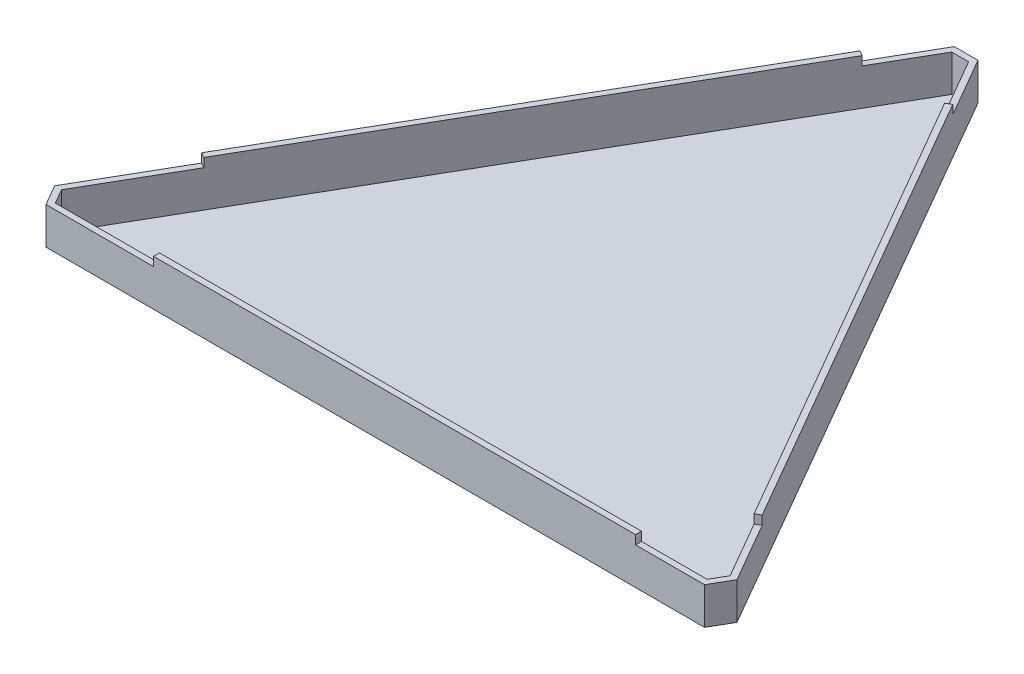
from build123d import *

# Parameters (mm, degrees)
BOSS_EXTRUDE1_DEPTH = 0.08
BOSS_EXTRUDE2_DEPTH = 12.46
SKETCH1_4_W         = 162.49
SKETCH1_4_H         = 2
BOSS_EXTRUDE3_DEPTH = 15.46


with BuildPart() as part:
    # Sketch1 → Boss-Extrude1 (new body)
    with BuildSketch(Plane(origin=(0, 0, 0), x_dir=(1, 0, 0), z_dir=(0, 1, 0))):
        Polygon((-115, 0), (-111, -6.92820323), (111, -6.92820323), (115, 0), (4, 192.25763964), (-4, 192.25763964), align=None)
    extrude(amount=BOSS_EXTRUDE1_DEPTH)

    # Sketch1<3> → Boss-Extrude2 (add)
    with BuildSketch(Plane(origin=(0, 0, 0), x_dir=(1, 0, 0), z_dir=(0, 1, 0))):
        Polygon((-96.87, 31.402081141), (-115, 0), (-111, -6.92820323), (-74.74, -6.92820323), (-74.74, -4.92820323), (-109.845299462, -4.92820323), (-112.690598923, 0), (-95.137949192, 30.402081141), align=None)
        Polygon((-4, 192.25763964), (-15.625, 172.122549002), (-13.892949192, 171.122549002), (-2.845299462, 190.25763964), (2.845299462, 190.25763964), (13.892949192, 171.122549002), (15.625, 172.122549002), (4, 192.25763964), align=None)
        Polygon((87.75, -4.92820323), (87.75, -6.92820323), (111, -6.92820323), (115, 0), (103.375, 20.135090638), (101.642949192, 19.135090638), (112.690598923, 0), (109.845299462, -4.92820323), align=None)
    extrude(amount=BOSS_EXTRUDE2_DEPTH)

    # Sketch1<4> → Boss-Extrude3 (add)
    with BuildSketch(Plane(origin=(0, 0, 0), x_dir=(1, 0, 0), z_dir=(0, 1, 0))):
        Polygon((-15.625, 172.122549002), (-96.87, 31.402081141), (-95.137949192, 30.402081141), (-13.892949192, 171.122549002), align=None)
        with Locations((6.505, -5.92820323)):
            Rectangle(SKETCH1_4_W, SKETCH1_4_H)
        Polygon((103.375, 20.135090638), (15.625, 172.122549002), (13.892949192, 171.122549002), (101.642949192, 19.135090638), align=None)
    extrude(amount=BOSS_EXTRUDE3_DEPTH)


solid = part.part
